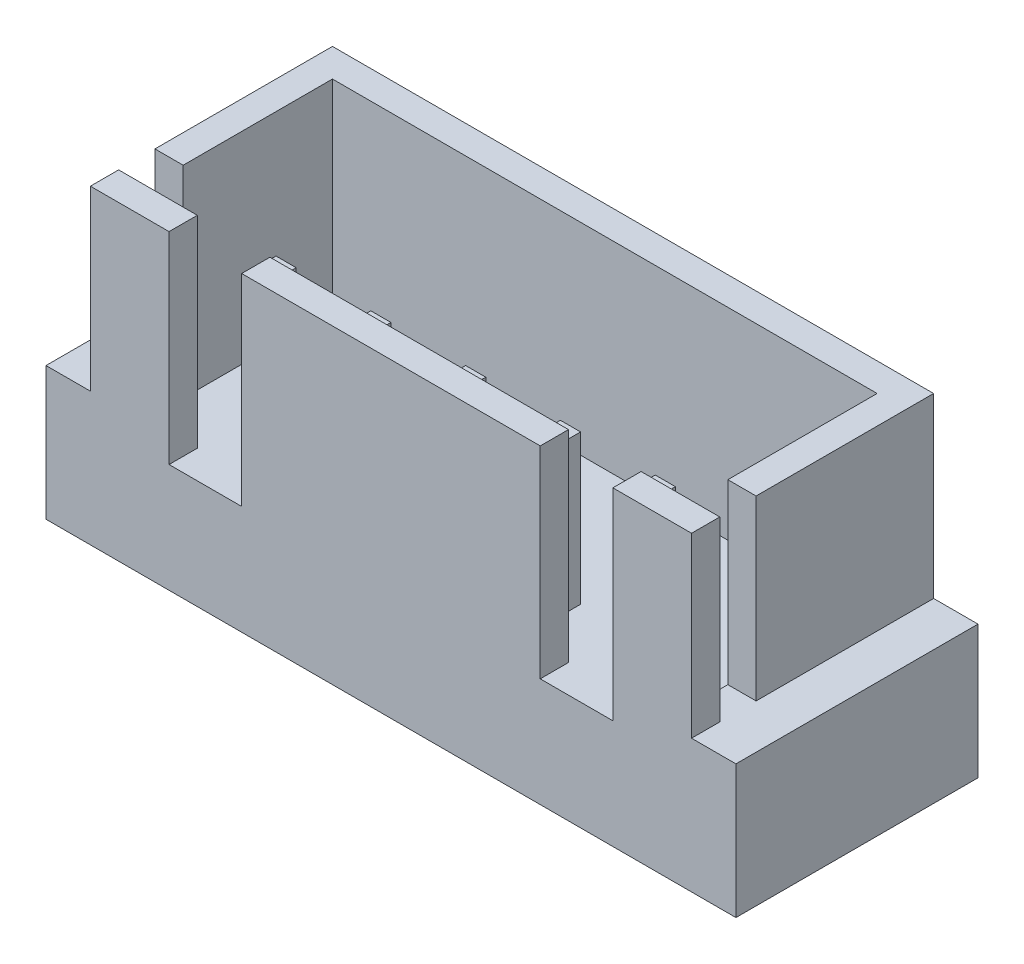
from build123d import *

# Parameters (mm, degrees)
SKETCH1_W           = 17.1
SKETCH1_H           = 6
BOSS_EXTRUDE1_DEPTH = 7.7
SKETCH2_W           = 13.5
SKETCH2_H           = 4.6
CUT_EXTRUDE1_DEPTH  = 5
SKETCH3_W           = 1.1
SKETCH3_H           = 6
CUT_EXTRUDE2_DEPTH  = 4.4
SKETCH4_W           = 1.8
SKETCH4_H           = 0.7
CUT_EXTRUDE3_DEPTH  = 5
SKETCH5_W           = 14.9
SKETCH5_H           = 0.9
CUT_EXTRUDE4_DEPTH  = 4.4
SKETCH6_W           = 0.5
SKETCH6_H           = 0.5
BOSS_EXTRUDE2_DEPTH = 3.7


with BuildPart() as part:
    # Sketch1 → Boss-Extrude1 (new body)
    with BuildSketch(Plane(origin=(0, 0, 0), x_dir=(1, 0, 0), z_dir=(0, 1, 0))):
        Rectangle(SKETCH1_W, SKETCH1_H)
    extrude(amount=BOSS_EXTRUDE1_DEPTH)

    # Sketch2 → Cut-Extrude1 (cut)
    with BuildSketch(Plane(origin=(0, 7.7, 0), x_dir=(1, 0, 0), z_dir=(0, 1, 0))):
        Rectangle(SKETCH2_W, SKETCH2_H)
    extrude(amount=-CUT_EXTRUDE1_DEPTH, mode=Mode.SUBTRACT)

    # Sketch3 → Cut-Extrude2 (cut)
    with BuildSketch(Plane(origin=(0, 7.7, 0), x_dir=(1, 0, 0), z_dir=(0, 1, 0))):
        with Locations((-8, 0)):
            Rectangle(SKETCH3_W, SKETCH3_H)
        with Locations((8, 0)):
            Rectangle(SKETCH3_W, SKETCH3_H)
    extrude(amount=-CUT_EXTRUDE2_DEPTH, mode=Mode.SUBTRACT)

    # Sketch4 → Cut-Extrude3 (cut)
    with BuildSketch(Plane(origin=(0, 7.7, 0), x_dir=(1, 0, 0), z_dir=(0, 1, 0))):
        with Locations((-4.6, -2.65)):
            Rectangle(SKETCH4_W, SKETCH4_H)
        with Locations((4.6, -2.65)):
            Rectangle(SKETCH4_W, SKETCH4_H)
    extrude(amount=-CUT_EXTRUDE3_DEPTH, mode=Mode.SUBTRACT)

    # Sketch5 → Cut-Extrude4 (cut)
    with BuildSketch(Plane(origin=(0, 7.7, 0), x_dir=(1, 0, 0), z_dir=(0, 1, 0))):
        with Locations((0, -1.85)):
            Rectangle(SKETCH5_W, SKETCH5_H)
    extrude(amount=-CUT_EXTRUDE4_DEPTH, mode=Mode.SUBTRACT)

    # Sketch6 → Boss-Extrude2 (add)
    with BuildSketch(Plane(origin=(0, 2.7, 0), x_dir=(1, 0, 0), z_dir=(0, 1, 0))):
        with Locations((0, -1.15)):
            Rectangle(SKETCH6_W, SKETCH6_H)
        with Locations((-2.35, -1.15)):
            Rectangle(SKETCH6_W, SKETCH6_H)
        with Locations((2.35, -1.15)):
            Rectangle(SKETCH6_W, SKETCH6_H)
        with Locations((4.7, -1.15)):
            Rectangle(SKETCH6_W, SKETCH6_H)
        with Locations((-4.7, -1.15)):
            Rectangle(SKETCH6_W, SKETCH6_H)
    extrude(amount=BOSS_EXTRUDE2_DEPTH)


solid = part.part
